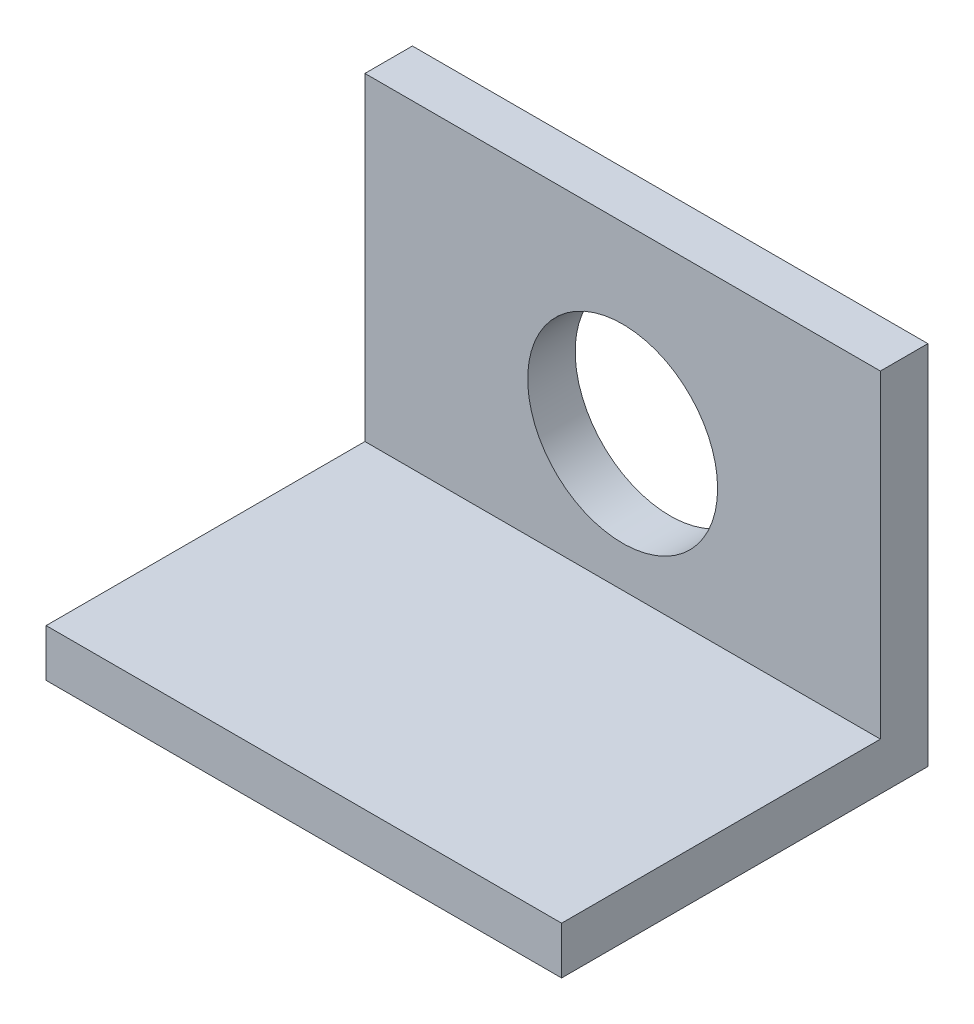
from build123d import *

# Parameters (mm, degrees)
ESQUISSE1_W        = 38
ESQUISSE1_H        = 23.5
ESQUISSE1_R        = 7
BOSS_EXTRU_1_DEPTH = 3.5
ESQUISSE1_4_W      = 38
ESQUISSE1_4_H      = 3.5
BOSS_EXTRU_2_DEPTH = 27


with BuildPart() as part:
    # Esquisse1 → Boss.-Extru.1 (new body)
    with BuildSketch(Plane.XY):
        with Locations((0, 15.25)):
            Rectangle(ESQUISSE1_W, ESQUISSE1_H)
        with Locations((0, 13.5)):
            Circle(ESQUISSE1_R, mode=Mode.SUBTRACT)
    extrude(amount=BOSS_EXTRU_1_DEPTH)

    # Esquisse1<4> → Boss.-Extru.2 (add)
    with BuildSketch(Plane.XY):
        with Locations((0, 1.75)):
            Rectangle(ESQUISSE1_4_W, ESQUISSE1_4_H)
    extrude(amount=BOSS_EXTRU_2_DEPTH)


solid = part.part
